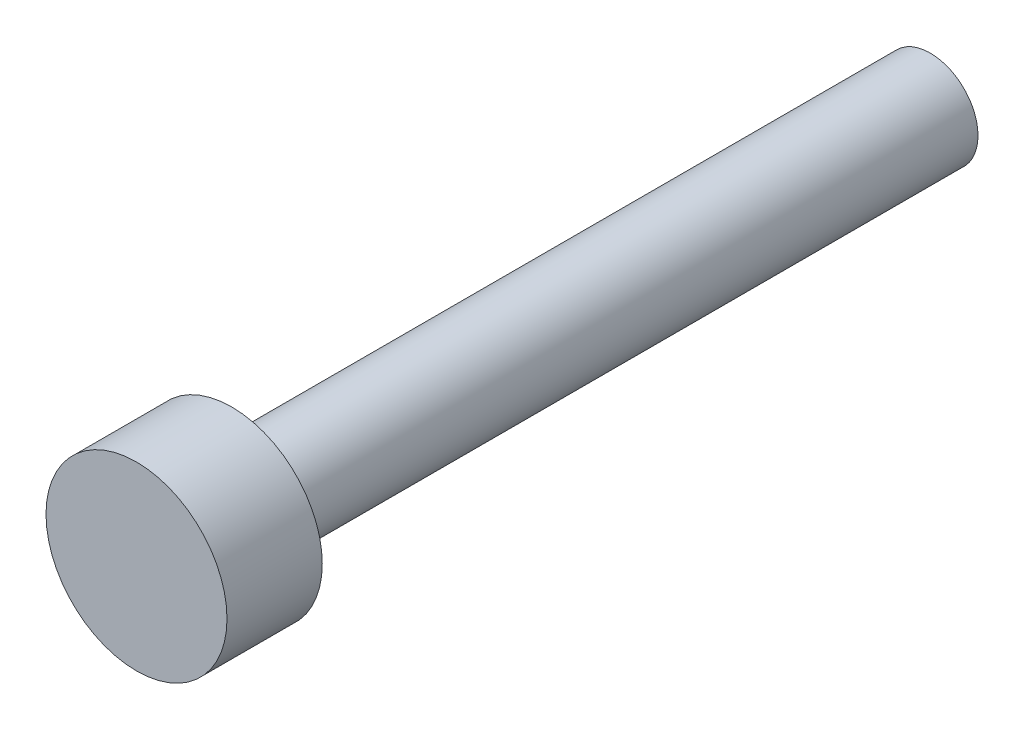
from build123d import *

# Parameters (mm, degrees)
SKETCH1_R           = 1.5
BOSS_EXTRUDE1_DEPTH = 22
SKETCH2_R           = 2.85
BOSS_EXTRUDE2_DEPTH = 3


with BuildPart() as part:
    # Sketch1 → Boss-Extrude1 (new body)
    with BuildSketch(Plane.XY):
        Circle(SKETCH1_R)
    extrude(amount=BOSS_EXTRUDE1_DEPTH)

    # Sketch2 → Boss-Extrude2 (add)
    with BuildSketch(Plane.XY.offset(22)):
        Circle(SKETCH2_R)
    extrude(amount=BOSS_EXTRUDE2_DEPTH)


solid = part.part
